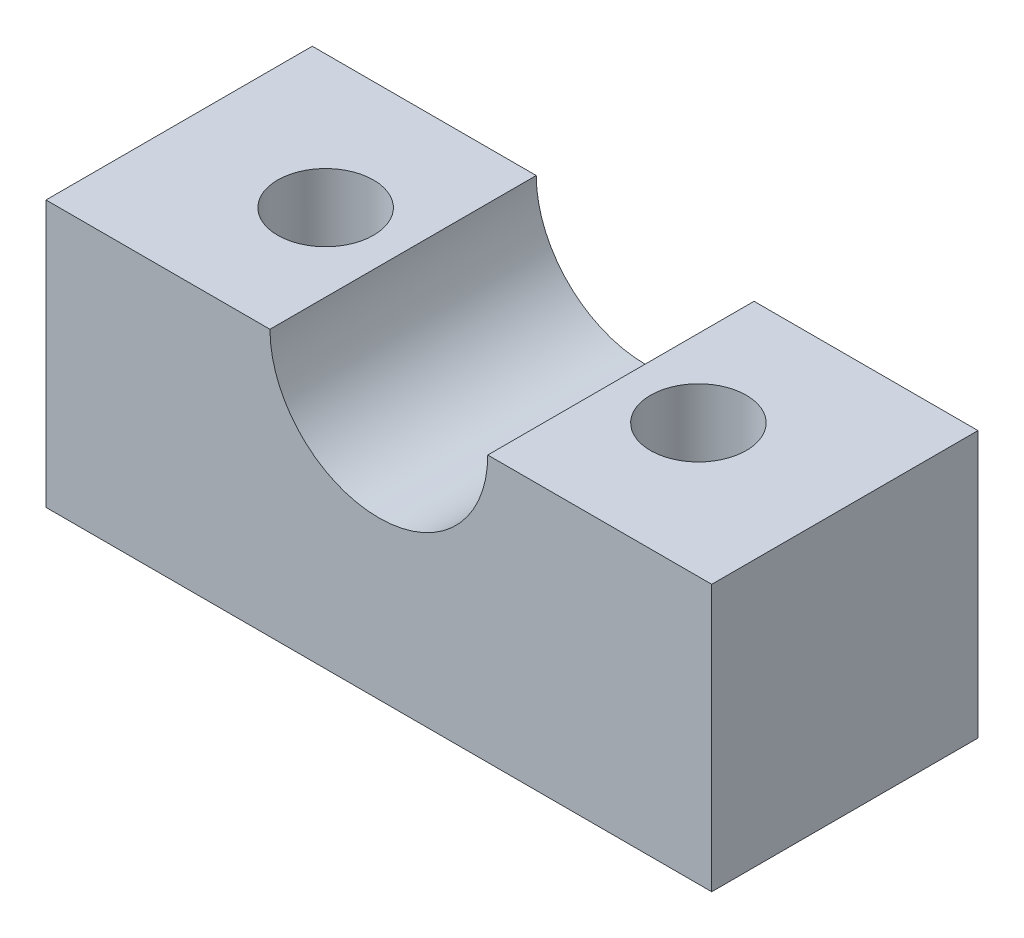
from build123d import *

# Parameters (mm, degrees)
MAIN_BODY_DEPTH   = 5
SCREW_HOLES_REACH = 18.771
SCHIZZO2_R        = 1.8


with BuildPart() as part:
    # Schizzo1 → Main body (new, symmetric)
    with BuildSketch(Plane.XY):
        with BuildLine():
            Line((-12.5, -5), (12.5, -5))
            Line((12.5, -5), (12.5, 5))
            Line((12.5, 5), (4.09, 5))
            ThreePointArc((4.09, 5), (0, 0.91), (-4.09, 5))
            Line((-4.09, 5), (-12.5, 5))
            Line((-12.5, 5), (-12.5, -5))
        make_face()
    extrude(amount=MAIN_BODY_DEPTH, both=True)

    # Schizzo2 → screw holes (cut, up to next)
    with BuildSketch(Plane.XZ.offset(5), mode=Mode.PRIVATE) as screw_holes_sk1:
        with Locations((-7, 0)):
            Circle(SCHIZZO2_R)
    screw_holes_tool1 = extrude(screw_holes_sk1.sketch, amount=-SCREW_HOLES_REACH, mode=Mode.PRIVATE) & part.part
    # Schizzo2 → screw holes (cut, up to next)
    with BuildSketch(Plane.XZ.offset(5), mode=Mode.PRIVATE) as screw_holes_sk2:
        with Locations((7, 0)):
            Circle(SCHIZZO2_R)
    screw_holes_tool2 = extrude(screw_holes_sk2.sketch, amount=-SCREW_HOLES_REACH, mode=Mode.PRIVATE) & part.part
    add(screw_holes_tool1.solids().sort_by_distance((-7, -5, 0))[0], mode=Mode.SUBTRACT)
    add(screw_holes_tool2.solids().sort_by_distance((7, -5, 0))[0], mode=Mode.SUBTRACT)


solid = part.part
